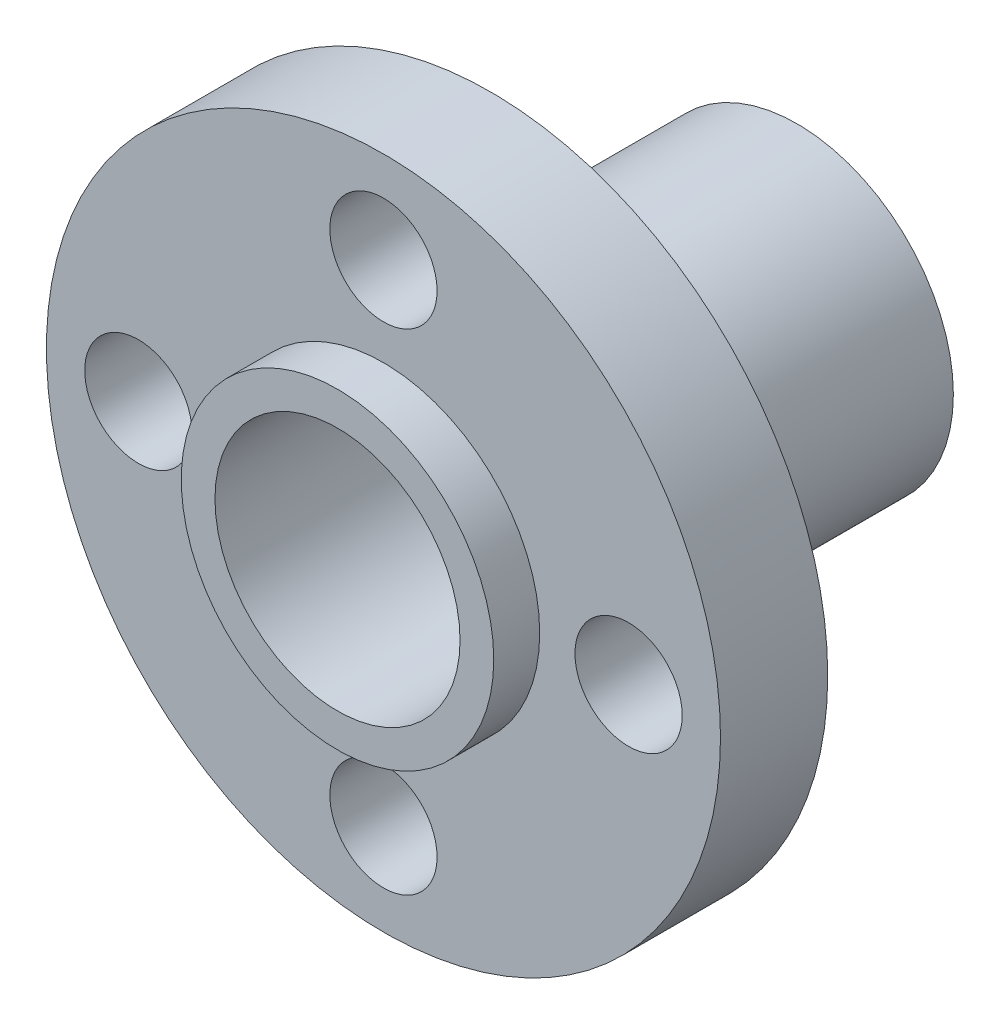
from build123d import *

# Parameters (mm, degrees)
SKETCH_1_R           = 11
SKETCH_1_R_2         = 5
SKETCH_1_R_3         = 1.75
EXTRUDE_1_DEPTH      = 3.5
EXTRUDE_2_DEPTH      = 1.5
EXTRUDE_2_DEPTH_BACK = 13.5
SKETCH_2_R           = 5.1
SKETCH_2_R_2         = 4


with BuildPart() as part:
    # 草图1 → 凸台-拉伸1 (new body)
    with BuildSketch(Plane.XY):
        Circle(SKETCH_1_R)
        Circle(SKETCH_1_R_2, mode=Mode.SUBTRACT)
        with Locations((0, 8)):
            Circle(SKETCH_1_R_3, mode=Mode.SUBTRACT)
        with Locations((8, 0)):
            Circle(SKETCH_1_R_3, mode=Mode.SUBTRACT)
        with Locations((0, -8)):
            Circle(SKETCH_1_R_3, mode=Mode.SUBTRACT)
        with Locations((-8, 0)):
            Circle(SKETCH_1_R_3, mode=Mode.SUBTRACT)
    extrude(amount=EXTRUDE_1_DEPTH)

    # 草图2 → 凸台-拉伸2 (add, two sides: drawn at the far end of the back side and taken through both)
    with BuildSketch(Plane.XY.offset(3.5).offset(-EXTRUDE_2_DEPTH_BACK)):
        Circle(SKETCH_2_R)
        Circle(SKETCH_2_R_2, mode=Mode.SUBTRACT)
    extrude(amount=EXTRUDE_2_DEPTH + EXTRUDE_2_DEPTH_BACK)


solid = part.part
